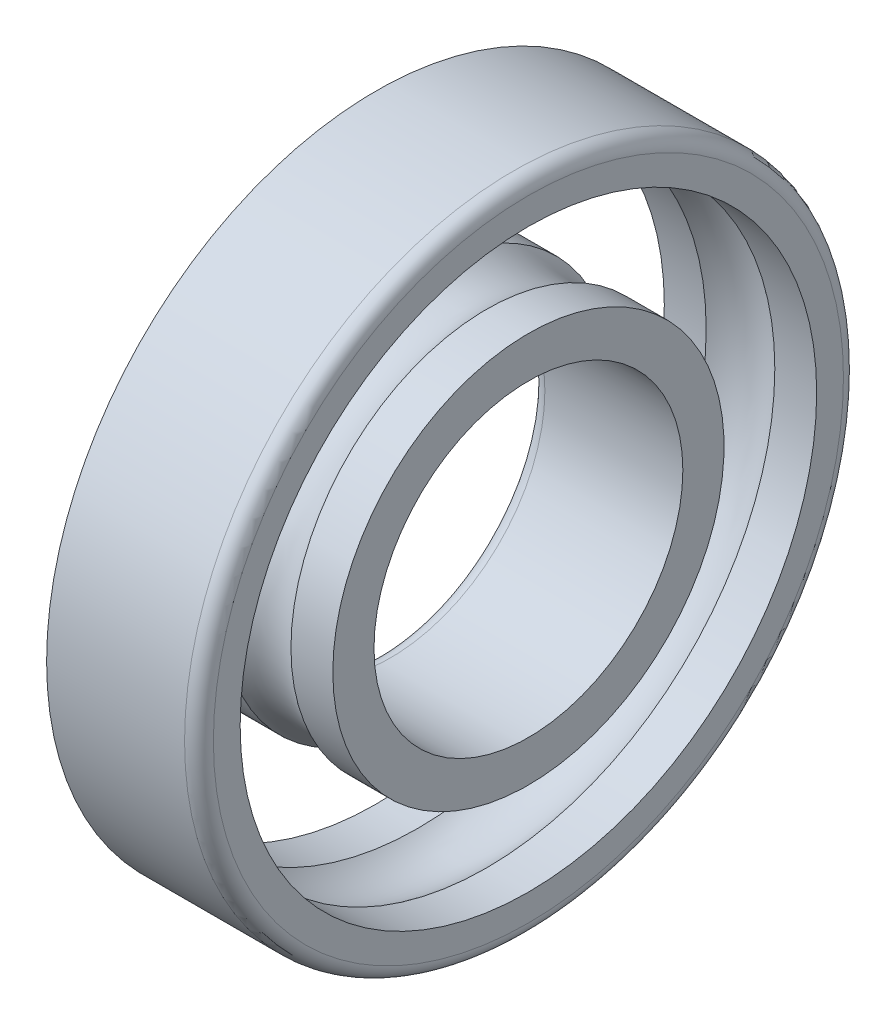
from build123d import *

# Parameters (mm, degrees)
FILLET_1_R = 3.5
FILLET_2_R = 3.5


with BuildPart() as part:
    # 草图1 → 旋转1 (revolve)
    with BuildSketch(Plane.XY, mode=Mode.PRIVATE) as revolve_1_sk:
        with BuildLine():
            Line((8.332916656, 70), (18.5, 70))
            Line((18.5, 70), (18.5, 80))
            Line((18.5, 80), (-18.5, 80))
            Line((-18.5, 80), (-18.5, 70))
            Line((-18.5, 70), (-8.332916656, 70))
            ThreePointArc((-8.332916656, 70), (0, 72.75), (8.332916656, 70))
        make_face()
        with BuildLine():
            Line((-18.5, 47.5), (-8.332916656, 47.5))
            ThreePointArc((-8.332916656, 47.5), (0, 44.75), (8.332916656, 47.5))
            Line((8.332916656, 47.5), (18.5, 47.5))
            Line((18.5, 47.5), (18.5, 37.5))
            Line((18.5, 37.5), (-18.5, 37.5))
            Line((-18.5, 37.5), (-18.5, 47.5))
        make_face()
    revolve(revolve_1_sk.sketch.rotate(Axis((-49.659284853, 0, 0), (1, 0, 0)), 90), axis=Axis((-49.659284853, 0, 0), (1, 0, 0)))

    # 圆角1
    fillet_1_edges = [part.edges().sort_by_distance(p)[0] for p in [
        (18.5, 0, -80),
    ]]
    fillet(fillet_1_edges, radius=FILLET_1_R)

    # 圆角2
    fillet_2_edges = [part.edges().sort_by_distance(p)[0] for p in [
        (-18.5, 0, -37.5),
    ]]
    fillet(fillet_2_edges, radius=FILLET_2_R)


solid = part.part
